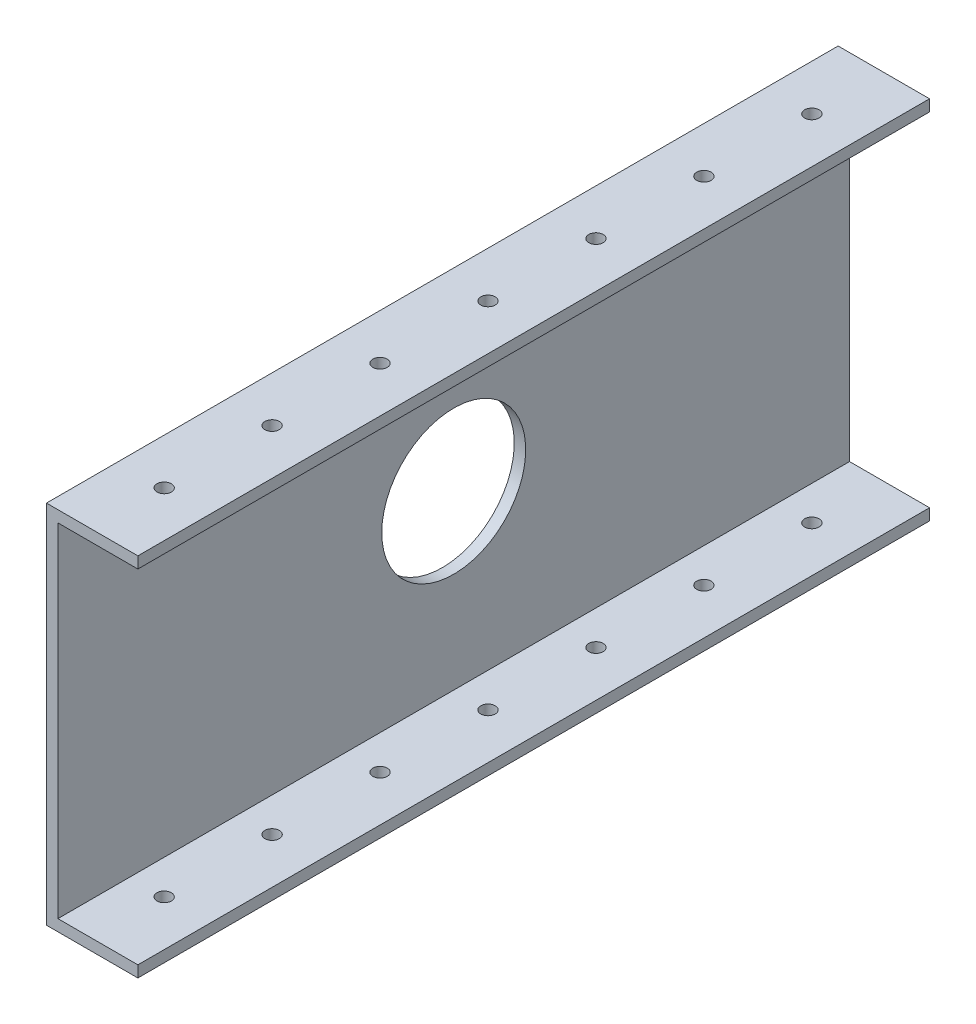
from build123d import *

# Parameters (mm, degrees)
BOSS_EXTRUDE1_DEPTH = 220
CUT_EXTRUDE1_REACH  = 245.655
SKETCH2_R           = 2
SKETCH3_R           = 20
CUT_EXTRUDE2_DEPTH  = 220


with BuildPart() as part:
    # Sketch1 → Boss-Extrude1 (new body)
    with BuildSketch(Plane.XY):
        Polygon((0, -51.046601942), (0, 50.553398058), (25.4, 50.553398058), (25.4, 47.378398058), (3.175, 47.378398058), (3.175, -47.871601942), (25.4, -47.871601942), (25.4, -51.046601942), align=None)
    extrude(amount=BOSS_EXTRUDE1_DEPTH)

    # Cut-Extrude1: up to this face of the body (flat: up to its plane)
    cut_extrude1_end = Plane(part.part.faces().sort_by_distance((12.7, -51.046601942, 110))[0])
    # Sketch2 → Cut-Extrude1 (cut, up to the picked face)
    with BuildSketch(Plane(origin=(0, 50.553398058, 0), x_dir=(1, 0, 0), z_dir=(0, 1, 0)), mode=Mode.PRIVATE) as cut_extrude1_sk1:
        with Locations(Location((12.7, -110, 0), (0, 0, 270))):
            Circle(SKETCH2_R)
    cut_extrude1_tool1 = split(extrude(cut_extrude1_sk1.sketch, amount=-CUT_EXTRUDE1_REACH, mode=Mode.PRIVATE), bisect_by=cut_extrude1_end, keep=Keep.BOTH, mode=Mode.PRIVATE)
    # Sketch2 → Cut-Extrude1 (cut, up to the picked face)
    with BuildSketch(Plane(origin=(0, 50.553398058, 0), x_dir=(1, 0, 0), z_dir=(0, 1, 0)), mode=Mode.PRIVATE) as cut_extrude1_sk2:
        with Locations(Location((12.7, -80, 0), (0, 0, 270))):
            Circle(SKETCH2_R)
    cut_extrude1_tool2 = split(extrude(cut_extrude1_sk2.sketch, amount=-CUT_EXTRUDE1_REACH, mode=Mode.PRIVATE), bisect_by=cut_extrude1_end, keep=Keep.BOTH, mode=Mode.PRIVATE)
    # Sketch2 → Cut-Extrude1 (cut, up to the picked face)
    with BuildSketch(Plane(origin=(0, 50.553398058, 0), x_dir=(1, 0, 0), z_dir=(0, 1, 0)), mode=Mode.PRIVATE) as cut_extrude1_sk3:
        with Locations(Location((12.7, -50, 0), (0, 0, 270))):
            Circle(SKETCH2_R)
    cut_extrude1_tool3 = split(extrude(cut_extrude1_sk3.sketch, amount=-CUT_EXTRUDE1_REACH, mode=Mode.PRIVATE), bisect_by=cut_extrude1_end, keep=Keep.BOTH, mode=Mode.PRIVATE)
    # Sketch2 → Cut-Extrude1 (cut, up to the picked face)
    with BuildSketch(Plane(origin=(0, 50.553398058, 0), x_dir=(1, 0, 0), z_dir=(0, 1, 0)), mode=Mode.PRIVATE) as cut_extrude1_sk4:
        with Locations(Location((12.7, -20, 0), (0, 0, 270))):
            Circle(SKETCH2_R)
    cut_extrude1_tool4 = split(extrude(cut_extrude1_sk4.sketch, amount=-CUT_EXTRUDE1_REACH, mode=Mode.PRIVATE), bisect_by=cut_extrude1_end, keep=Keep.BOTH, mode=Mode.PRIVATE)
    # Sketch2 → Cut-Extrude1 (cut, up to the picked face)
    with BuildSketch(Plane(origin=(0, 50.553398058, 0), x_dir=(1, 0, 0), z_dir=(0, 1, 0)), mode=Mode.PRIVATE) as cut_extrude1_sk5:
        with Locations(Location((12.7, -140, 0), (0, 0, 270))):
            Circle(SKETCH2_R)
    cut_extrude1_tool5 = split(extrude(cut_extrude1_sk5.sketch, amount=-CUT_EXTRUDE1_REACH, mode=Mode.PRIVATE), bisect_by=cut_extrude1_end, keep=Keep.BOTH, mode=Mode.PRIVATE)
    # Sketch2 → Cut-Extrude1 (cut, up to the picked face)
    with BuildSketch(Plane(origin=(0, 50.553398058, 0), x_dir=(1, 0, 0), z_dir=(0, 1, 0)), mode=Mode.PRIVATE) as cut_extrude1_sk6:
        with Locations(Location((12.7, -170, 0), (0, 0, 270))):
            Circle(SKETCH2_R)
    cut_extrude1_tool6 = split(extrude(cut_extrude1_sk6.sketch, amount=-CUT_EXTRUDE1_REACH, mode=Mode.PRIVATE), bisect_by=cut_extrude1_end, keep=Keep.BOTH, mode=Mode.PRIVATE)
    # Sketch2 → Cut-Extrude1 (cut, up to the picked face)
    with BuildSketch(Plane(origin=(0, 50.553398058, 0), x_dir=(1, 0, 0), z_dir=(0, 1, 0)), mode=Mode.PRIVATE) as cut_extrude1_sk7:
        with Locations(Location((12.7, -200, 0), (0, 0, 270))):
            Circle(SKETCH2_R)
    cut_extrude1_tool7 = split(extrude(cut_extrude1_sk7.sketch, amount=-CUT_EXTRUDE1_REACH, mode=Mode.PRIVATE), bisect_by=cut_extrude1_end, keep=Keep.BOTH, mode=Mode.PRIVATE)
    add(cut_extrude1_tool1.solids().sort_by(Axis((12.7, 50.553398, 110), (0, -1, 0)))[0], mode=Mode.SUBTRACT)
    add(cut_extrude1_tool2.solids().sort_by(Axis((12.7, 50.553398, 80), (0, -1, 0)))[0], mode=Mode.SUBTRACT)
    add(cut_extrude1_tool3.solids().sort_by(Axis((12.7, 50.553398, 50), (0, -1, 0)))[0], mode=Mode.SUBTRACT)
    add(cut_extrude1_tool4.solids().sort_by(Axis((12.7, 50.553398, 20), (0, -1, 0)))[0], mode=Mode.SUBTRACT)
    add(cut_extrude1_tool5.solids().sort_by(Axis((12.7, 50.553398, 140), (0, -1, 0)))[0], mode=Mode.SUBTRACT)
    add(cut_extrude1_tool6.solids().sort_by(Axis((12.7, 50.553398, 170), (0, -1, 0)))[0], mode=Mode.SUBTRACT)
    add(cut_extrude1_tool7.solids().sort_by(Axis((12.7, 50.553398, 200), (0, -1, 0)))[0], mode=Mode.SUBTRACT)

    # Sketch3 → Cut-Extrude2 (cut)
    with BuildSketch(Plane.ZY):
        with Locations((110, 0)):
            Circle(SKETCH3_R)
    extrude(amount=-CUT_EXTRUDE2_DEPTH, mode=Mode.SUBTRACT)


solid = part.part
